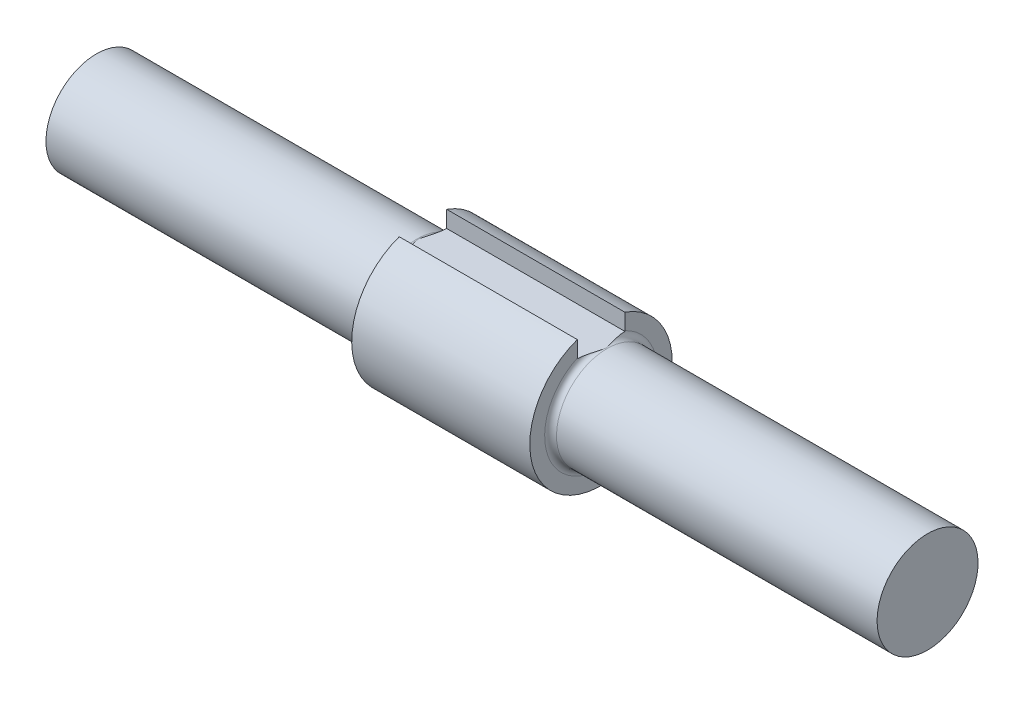
from build123d import *

# Parameters (mm, degrees)
CUT_EXTRUDE2_DEPTH      = 87.677563418
CUT_EXTRUDE2_DEPTH_BACK = 87.677563418
SKETCH3_W               = 4
SKETCH3_H               = 2.8


with BuildPart() as part:
    # Sketch1 → Revolve1 (revolve)
    with BuildSketch(Plane.XY, mode=Mode.PRIVATE) as revolve1_sk:
        with BuildLine():
            Line((0, 0), (55, 0))
            Line((55, 0), (55, 8.5))
            Line((55, 8.5), (1, 8.5))
            ThreePointArc((1, 8.5), (0.292893219, 8.792893219), (0, 9.5))
            Line((0, 9.5), (0, 12))
            Line((0, 12), (-30, 12))
            Line((-30, 12), (-30, 9.5))
            ThreePointArc((-30, 9.5), (-30.292893219, 8.792893219), (-31, 8.5))
            Line((-31, 8.5), (-85, 8.5))
            Line((-85, 8.5), (-85, 0))
            Line((-85, 0), (0, 0))
        make_face()
    revolve(revolve1_sk.sketch.rotate(Axis((-85, 0, 0), (1, 0, 0)), 180), axis=Axis((-85, 0, 0), (1, 0, 0)))

    # Sketch3 → Cut-Extrude2 (cut, two sides: drawn at the far end of the back side and taken through both)
    with BuildSketch(Plane(origin=(0, 0, 0), x_dir=(0, 0, -1), z_dir=(1, 0, 0)).offset(-CUT_EXTRUDE2_DEPTH_BACK)):
        with Locations((2, 9.913708499)):
            Rectangle(SKETCH3_W, SKETCH3_H)
        with Locations((-2, 9.913708499)):
            Rectangle(SKETCH3_W, SKETCH3_H)
        with BuildLine():
            Line((-4, 11.313708499), (0, 11.313708499))
            Line((0, 11.313708499), (0, 12))
            ThreePointArc((0, 12), (-2.029223745, 11.827182716), (-4, 11.313708499))
        make_face()
        with BuildLine():
            Line((0, 12), (0, 11.313708499))
            Line((0, 11.313708499), (4, 11.313708499))
            ThreePointArc((4, 11.313708499), (2.029223745, 11.827182716), (0, 12))
        make_face()
    extrude(amount=CUT_EXTRUDE2_DEPTH + CUT_EXTRUDE2_DEPTH_BACK, mode=Mode.SUBTRACT)


solid = part.part
